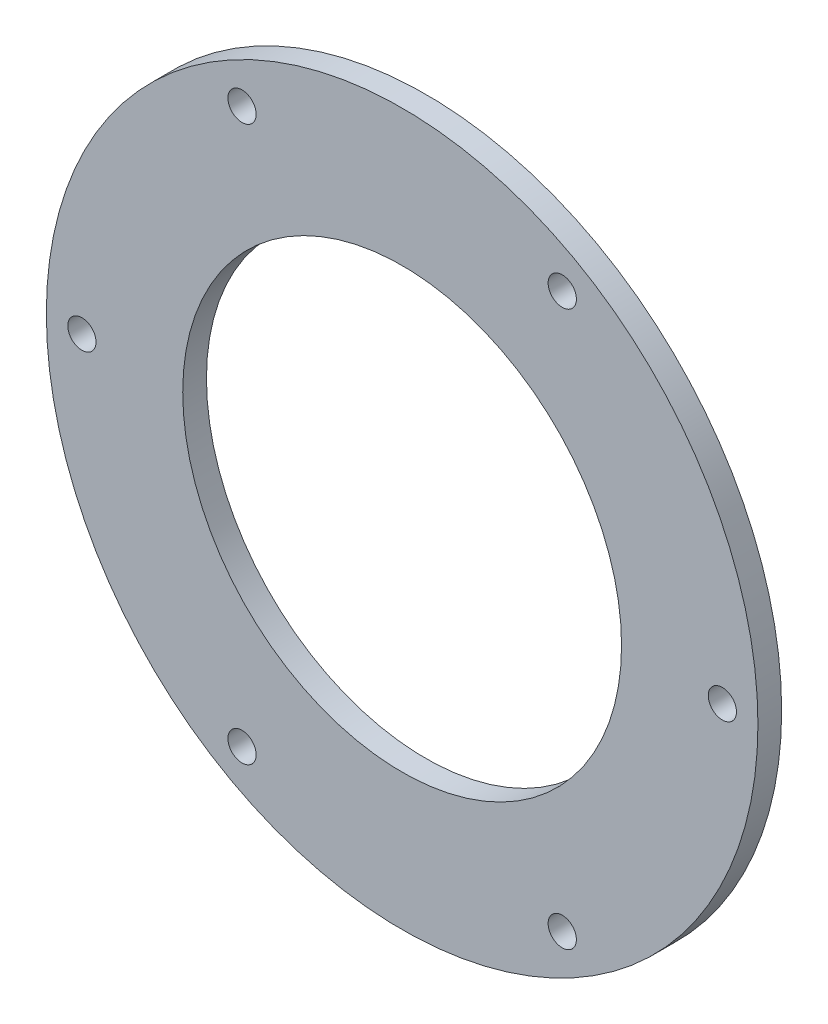
from build123d import *

# Parameters (mm, degrees)
SKETCH1_R                   = 60
SKETCH1_R_2                 = 37
BOSS_EXTRUDE1_DEPTH         = 4
F_3_16_0_1875_DOWEL_HOLE1_D = 4.7625


with BuildPart() as part:
    # Sketch1 → Boss-Extrude1 (new body)
    with BuildSketch(Plane.XY):
        Circle(SKETCH1_R)
        Circle(SKETCH1_R_2, mode=Mode.SUBTRACT)
    extrude(amount=BOSS_EXTRUDE1_DEPTH)

    # 3/16 (0.1875) Dowel Hole1 (through all)
    with Locations(Plane(origin=(-54, 0, 4), x_dir=(1, 0, 0), z_dir=(0, 0, 1))):
        with Locations((0, 0), (108, 0), (27, 46.765371804), (27, -46.765371804), (81, 46.765371804), (81, -46.765371804)):
            Hole(F_3_16_0_1875_DOWEL_HOLE1_D / 2)


solid = part.part
